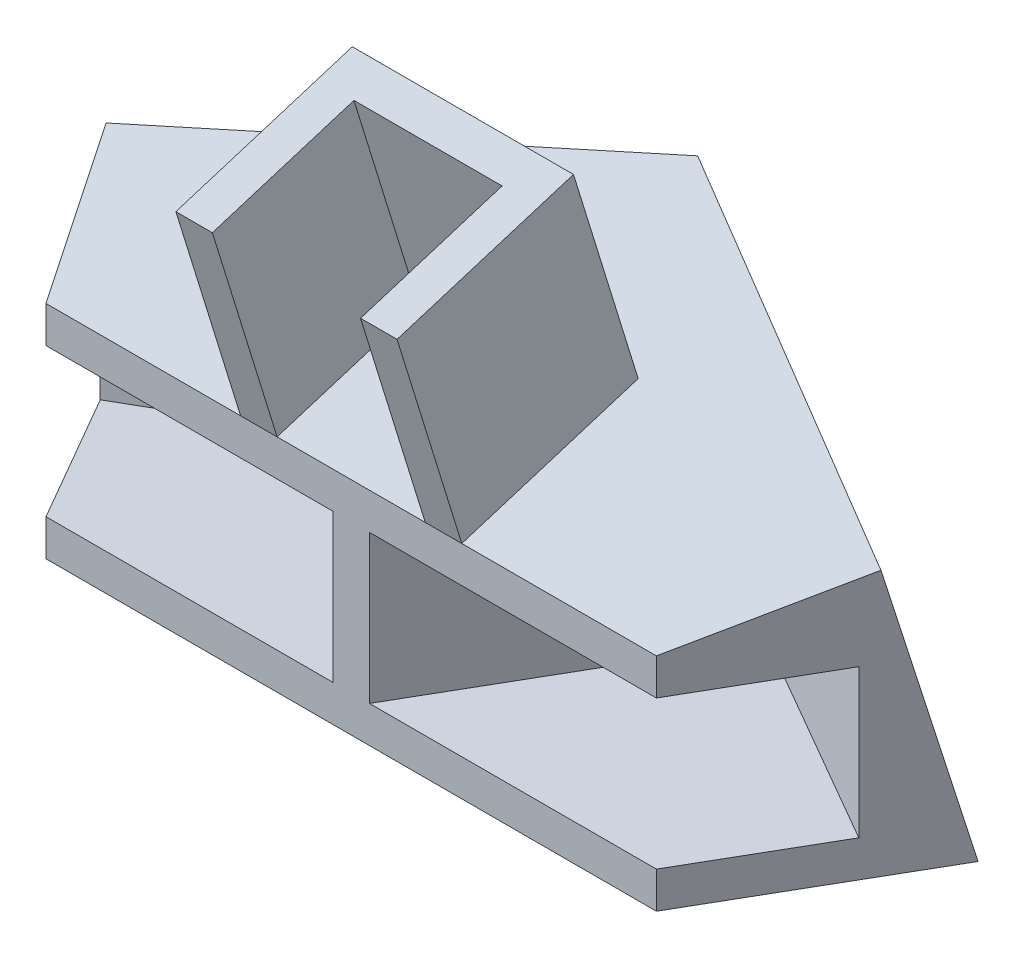
from build123d import *

# Parameters (mm, degrees)
BOSS_EXTRUDE2_DEPTH = 5
BOSS_EXTRUDE3_DEPTH = 20.3
BOSS_EXTRUDE4_DEPTH = 5
BOSS_EXTRUDE5_DEPTH = 50
CUT_EXTRUDE5_DEPTH  = 120.550160374
CUT_EXTRUDE6_DEPTH  = 106.793534237
BOSS_EXTRUDE6_DEPTH = 30
BOSS_EXTRUDE7_DEPTH = 20.3


with BuildPart() as part:
    # Sketch3 → Boss-Extrude2 (new body)
    with BuildSketch(Plane(origin=(0, 0, 0), x_dir=(1, 0, 0), z_dir=(0, 1, 0))):
        Polygon((-54.461524227, -2.229452052), (-41.811524227, -24.139894768), (0, -24.139894768), (0, 29.213923621), (0, 53.936652846), (-65.166780007, 16.312594867), align=None)
    boss_extrude2 = extrude(amount=BOSS_EXTRUDE2_DEPTH)

    # Sketch4 → Boss-Extrude3 (add)
    with BuildSketch(Plane(origin=(0, 5, 0), x_dir=(1, 0, 0), z_dir=(0, 1, 0))):
        Polygon((-51.961524227, -6.559579071), (0, 23.440420929), (0, 29.213923621), (0, 53.936652846), (-65.166780007, 16.312594867), (-54.461524227, -2.229452052), align=None)
    boss_extrude3 = extrude(amount=BOSS_EXTRUDE3_DEPTH)

    # Sketch5 → Boss-Extrude4 (add)
    with BuildSketch(Plane(origin=(0, 25.3, 0), x_dir=(1, 0, 0), z_dir=(0, 1, 0))):
        Polygon((-65.166780007, 16.312594867), (-41.811524227, -24.139894768), (0, -24.139894768), (0, 53.936652846), align=None)
    boss_extrude4 = extrude(amount=BOSS_EXTRUDE4_DEPTH)

    # Sketch7 → Boss-Extrude5 (add)
    with BuildSketch(Plane(origin=(0, 30.3, 0), x_dir=(1, 0, 0), z_dir=(0, 1, 0))):
        Polygon((-65.166780007, 16.312594867), (0, 53.936652846), (0, -24.139894768), (-41.811524227, -24.139894768), align=None)
    boss_extrude5 = extrude(amount=BOSS_EXTRUDE5_DEPTH)

    # Sketch12 → Cut-Extrude5 (cut, through all)
    with BuildSketch(Plane(origin=(-41.811524227, 0, 24.139894768), x_dir=(0.5000000000000006, 0, 0.8660254037844384), z_dir=(-0.8660254037844384, 0, 0.5000000000000006))):
        Polygon((-46.71051156, 80.3), (-46.71051156, 0), (-32.255495471, 0), (-10.739175318, 80.3), align=None)
    cut_extrude5 = extrude(amount=-CUT_EXTRUDE5_DEPTH, mode=Mode.SUBTRACT)

    # Sketch16 → Cut-Extrude6 (cut, through all)
    with BuildSketch(Plane(origin=(0, 0, 0), x_dir=(0, 0, -1), z_dir=(1, 0, 0))):
        Polygon((-24.139894768, 30.3), (23.326658439, 44.986202672), (12.400531522, 80.3), (-24.139894768, 80.3), align=None)
    cut_extrude6 = extrude(amount=-CUT_EXTRUDE6_DEPTH, mode=Mode.SUBTRACT)

    # Sketch17 → Boss-Extrude6 (add)
    with BuildSketch(Plane(origin=(0, 34.469205914, 10.664809425), x_dir=(1, 0, 0), z_dir=(0, 0.9553190031279326, 0.2955767282156244))):
        Polygon((-10.15, -14.10532534), (-10.15, 6.19467466), (0, 6.19467466), (0, 11.19467466), (-15.15, 11.19467466), (-15.15, -14.10532534), align=None)
    boss_extrude6 = extrude(amount=BOSS_EXTRUDE6_DEPTH)

    # Sketch18 → Boss-Extrude7 (add)
    with BuildSketch(Plane(origin=(0, 5, 0), x_dir=(1, 0, 0), z_dir=(0, 1, 0))):
        Polygon((0, -24.139894768), (-2.5, -24.139894768), (-22.477881057, 10.46281025), (0, 23.440420929), align=None)
    boss_extrude7 = extrude(amount=BOSS_EXTRUDE7_DEPTH)

    # Mirror2: Boss-Extrude2, Boss-Extrude3, Boss-Extrude4, Boss-Extrude5, Cut-Extrude5, Cut-Extrude6, Boss-Extrude6, Boss-Extrude7 across plane
    add(boss_extrude2.mirror(Plane(origin=(0, 5, -53.936652846), x_dir=(0, 0, 1), z_dir=(-1, 0, 0))))
    add(boss_extrude3.mirror(Plane(origin=(0, 5, -53.936652846), x_dir=(0, 0, 1), z_dir=(-1, 0, 0))))
    add(boss_extrude4.mirror(Plane(origin=(0, 5, -53.936652846), x_dir=(0, 0, 1), z_dir=(-1, 0, 0))))
    add(boss_extrude5.mirror(Plane(origin=(0, 5, -53.936652846), x_dir=(0, 0, 1), z_dir=(-1, 0, 0))))
    add(cut_extrude5.mirror(Plane(origin=(0, 5, -53.936652846), x_dir=(0, 0, 1), z_dir=(-1, 0, 0))), mode=Mode.SUBTRACT)
    add(cut_extrude6.mirror(Plane(origin=(0, 5, -53.936652846), x_dir=(0, 0, 1), z_dir=(-1, 0, 0))), mode=Mode.SUBTRACT)
    add(boss_extrude6.mirror(Plane(origin=(0, 5, -53.936652846), x_dir=(0, 0, 1), z_dir=(-1, 0, 0))))
    add(boss_extrude7.mirror(Plane(origin=(0, 5, -53.936652846), x_dir=(0, 0, 1), z_dir=(-1, 0, 0))))


solid = part.part
